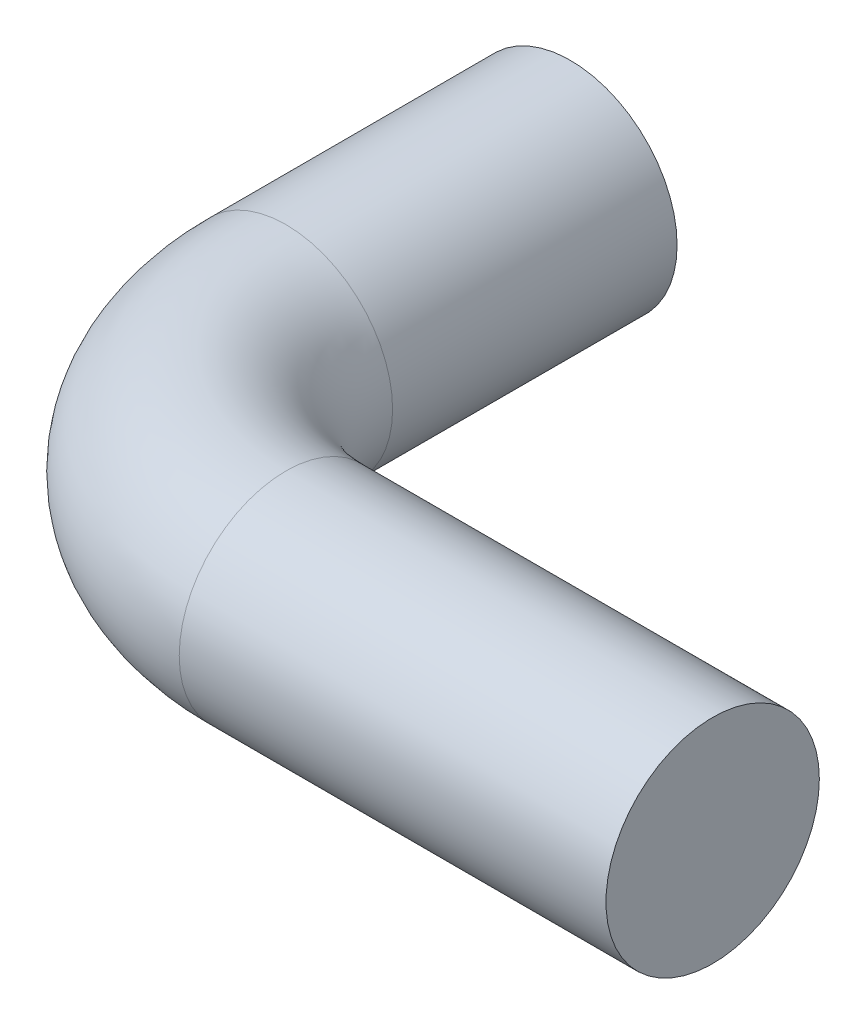
from build123d import *

# Parameters (mm, degrees)
SWEEP1_PROFILE_R = 37.5


with BuildPart() as part:
    # Sweep1: sweep along a path in Sketch2
    with BuildLine(Plane(origin=(0, 0, 0), x_dir=(1, 0, 0), z_dir=(0, 1, 0))) as sweep1_path:
        Line((150, 0), (0, 0))
        ThreePointArc((0, 0), (-53.033008589, 21.966991411), (-75, 75))
        Line((-75, 75), (-75, 175))
    # Sweep1 profile (on start of the path) → Sweep1 (sweep)
    with BuildSketch(Plane(origin=(150, 0, 0), x_dir=(0, 0, -1), z_dir=(-1, 0, 0))):
        Circle(SWEEP1_PROFILE_R)
    sweep(path=sweep1_path.line)


solid = part.part
